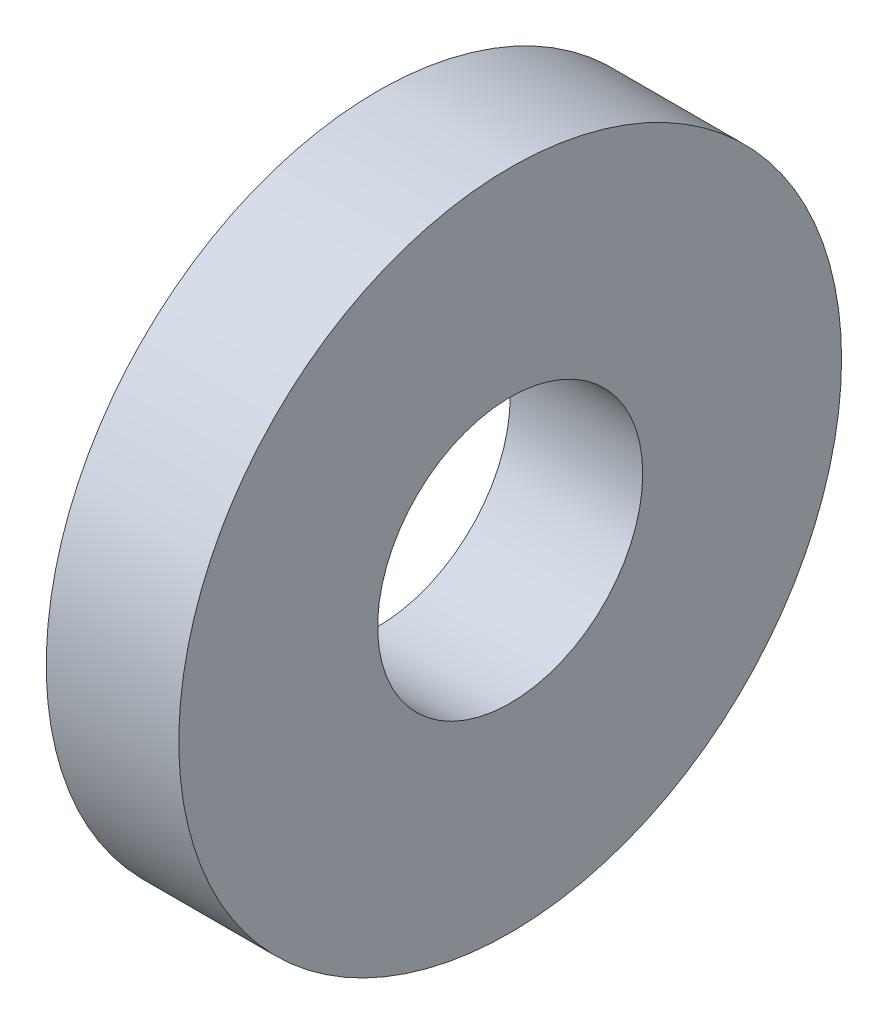
from build123d import *

# Parameters (mm, degrees)
SKETCH4_R           = 12.5
SKETCH4_R_2         = 5
BOSS_EXTRUDE1_DEPTH = 2.5


with BuildPart() as part:
    # Sketch4 → Boss-Extrude1 (new, symmetric)
    with BuildSketch(Plane(origin=(0, 0, 0), x_dir=(0, 0, -1), z_dir=(1, 0, 0))):
        Circle(SKETCH4_R)
        Circle(SKETCH4_R_2, mode=Mode.SUBTRACT)
    extrude(amount=BOSS_EXTRUDE1_DEPTH, both=True)


solid = part.part
